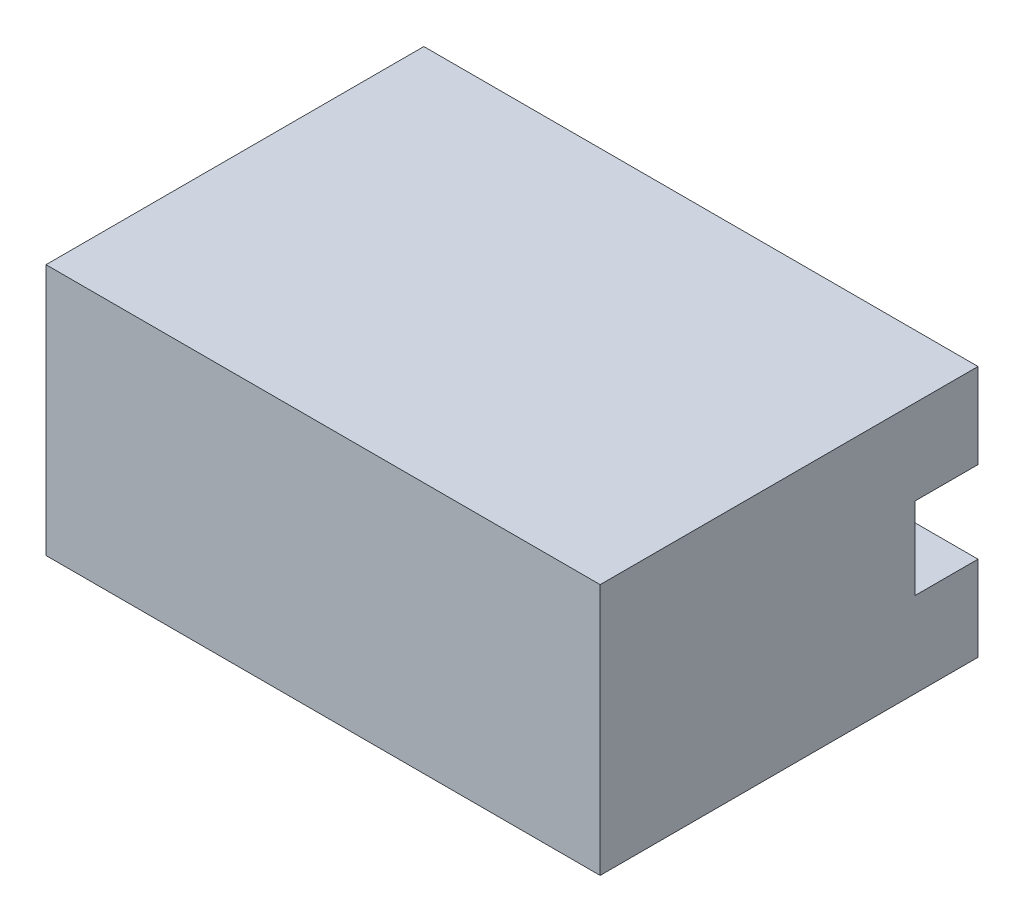
from build123d import *

# Parameters (mm, degrees)
SKETCH1_W           = 30
SKETCH1_H           = 10
BOSS_EXTRUDE1_DEPTH = 6.5
SKETCH3_W           = 13
SKETCH3_H           = 22
CUT_EXTRUDE3_DEPTH  = 20.163767897
SKETCH10_W          = 13
SKETCH10_H          = 10
BOSS_EXTRUDE3_DEPTH = 3
SKETCH12_W          = 22
SKETCH12_H          = 3.25
CUT_EXTRUDE5_DEPTH  = 0.5
SKETCH15_W          = 22
SKETCH15_H          = 3.375
BOSS_EXTRUDE6_DEPTH = 2


with BuildPart() as part:
    # Sketch1 → Boss-Extrude1 (new, symmetric)
    with BuildSketch(Plane.XY):
        Rectangle(SKETCH1_W, SKETCH1_H)
    extrude(amount=BOSS_EXTRUDE1_DEPTH, both=True)

    # Sketch3 → Cut-Extrude3 (cut, through all)
    with BuildSketch(Plane.XZ.offset(5)):
        with Locations((10.5, 0)):
            Rectangle(SKETCH3_W, SKETCH3_H)
    extrude(amount=-CUT_EXTRUDE3_DEPTH, mode=Mode.SUBTRACT)

    # Sketch10 → Boss-Extrude3 (add)
    with BuildSketch(Plane(origin=(4, 0, 0), x_dir=(0, 0, -1), z_dir=(1, 0, 0))):
        Rectangle(SKETCH10_W, SKETCH10_H)
    extrude(amount=BOSS_EXTRUDE3_DEPTH)

    # Sketch12 → Cut-Extrude5 (cut)
    with BuildSketch(Plane(origin=(0, 0, -6.5), x_dir=(-1, 0, 0), z_dir=(0, 0, -1))):
        with Locations((4, 0)):
            Rectangle(SKETCH12_W, SKETCH12_H)
    extrude(amount=-CUT_EXTRUDE5_DEPTH, mode=Mode.SUBTRACT)

    # Sketch15 → Boss-Extrude6 (add)
    with BuildSketch(Plane(origin=(0, 0, -6.5), x_dir=(-1, 0, 0), z_dir=(0, 0, -1))):
        with Locations((4, 3.3125)):
            Rectangle(SKETCH15_W, SKETCH15_H)
    boss_extrude6 = extrude(amount=BOSS_EXTRUDE6_DEPTH)

    # Mirror5: Boss-Extrude6 across plane
    add(boss_extrude6.mirror(Plane.ZX))


solid = part.part
